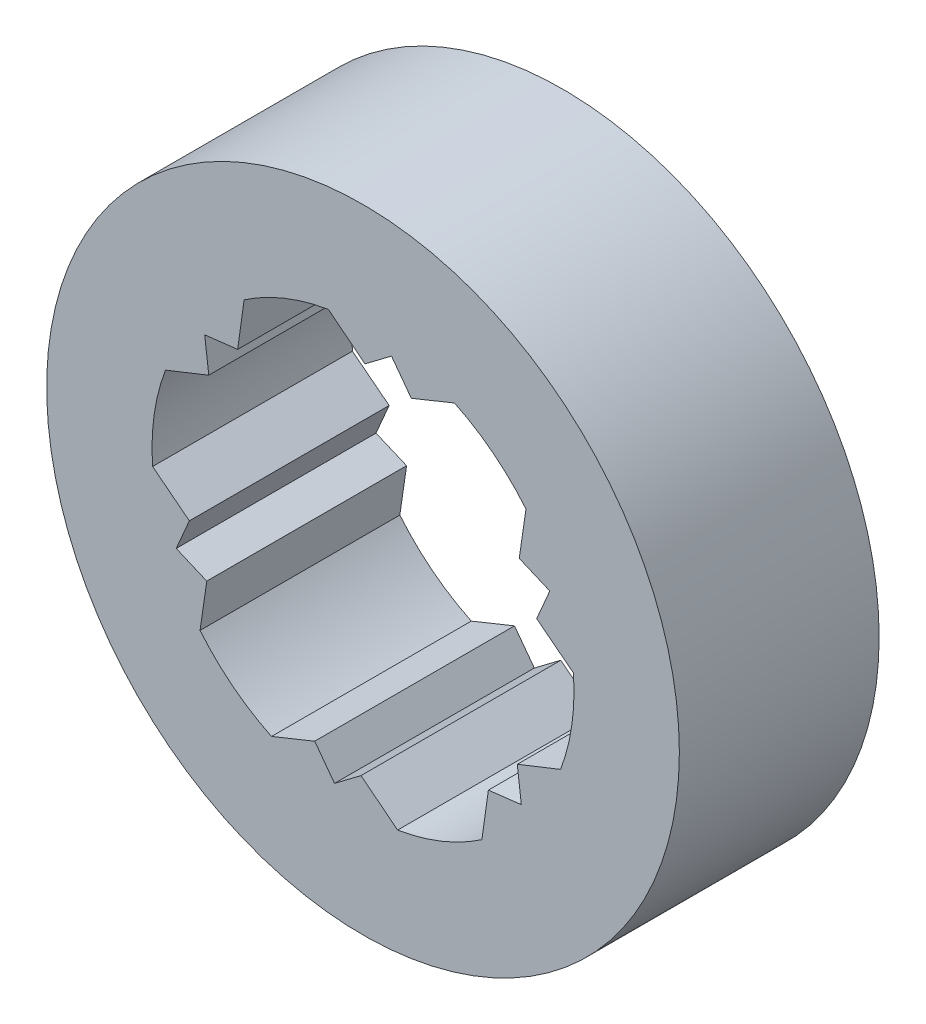
from build123d import *

# Parameters (mm, degrees)
SKETCH5_R           = 4.75
BOSS_EXTRUDE1_DEPTH = 3


with BuildPart() as part:
    # Sketch5 → Boss-Extrude1 (new body)
    with BuildSketch(Plane.XY):
        with Locations((-6.126935789, 33.595569574)):
            Circle(SKETCH5_R)
        with BuildLine():
            Line((-6.156694041, 30.903989601), (-5.607416869, 30.470060358))
            ThreePointArc((-5.607416869, 30.470060358), (-4.946880208, 30.65513141), (-4.341658129, 30.978034198))
            Line((-4.341658129, 30.978034198), (-4.244743599, 31.671292861))
            Line((-4.244743599, 31.671292861), (-3.749736881, 31.729366119))
            Line((-3.749736881, 31.729366119), (-3.810838281, 32.224008185))
            Line((-3.810838281, 32.224008185), (-3.160405947, 32.482731548))
            ThreePointArc((-3.160405947, 32.482731548), (-2.99041385, 33.147308603), (-2.967444827, 33.832897692))
            Line((-2.967444827, 33.832897692), (-3.519367176, 34.263457468))
            Line((-3.519367176, 34.263457468), (-3.322156734, 34.721182491))
            Line((-3.322156734, 34.721182491), (-3.781080029, 34.915588159))
            Line((-3.781080029, 34.915588159), (-3.679924867, 35.608240765))
            ThreePointArc((-3.679924867, 35.608240765), (-4.170469431, 36.087746767), (-4.752722487, 36.450433069))
            Line((-4.752722487, 36.450433069), (-5.401559365, 36.187734182))
            Line((-5.401559365, 36.187734182), (-5.699355642, 36.587385946))
            Line((-5.699355642, 36.587385946), (-6.097177536, 36.287149548))
            Line((-6.097177536, 36.287149548), (-6.646454709, 36.721078791))
            ThreePointArc((-6.646454709, 36.721078791), (-7.30699137, 36.536007739), (-7.912213449, 36.213104951))
            Line((-7.912213449, 36.213104951), (-8.009127978, 35.519846288))
            Line((-8.009127978, 35.519846288), (-8.504134696, 35.46177303))
            Line((-8.504134696, 35.46177303), (-8.443033296, 34.967130964))
            Line((-8.443033296, 34.967130964), (-9.09346563, 34.7084076))
            ThreePointArc((-9.09346563, 34.7084076), (-9.263457727, 34.043830546), (-9.28642675, 33.358241457))
            Line((-9.28642675, 33.358241457), (-8.734504401, 32.92768168))
            Line((-8.734504401, 32.92768168), (-8.931714844, 32.469956658))
            Line((-8.931714844, 32.469956658), (-8.472791548, 32.27555099))
            Line((-8.472791548, 32.27555099), (-8.57394671, 31.582898384))
            ThreePointArc((-8.57394671, 31.582898384), (-8.083402147, 31.103392381), (-7.50114909, 30.74070608))
            Line((-7.50114909, 30.74070608), (-6.852312212, 31.003404967))
            Line((-6.852312212, 31.003404967), (-6.554515936, 30.603753203))
            Line((-6.554515936, 30.603753203), (-6.156694041, 30.903989601))
        make_face(mode=Mode.SUBTRACT)
    extrude(amount=BOSS_EXTRUDE1_DEPTH)


solid = part.part
